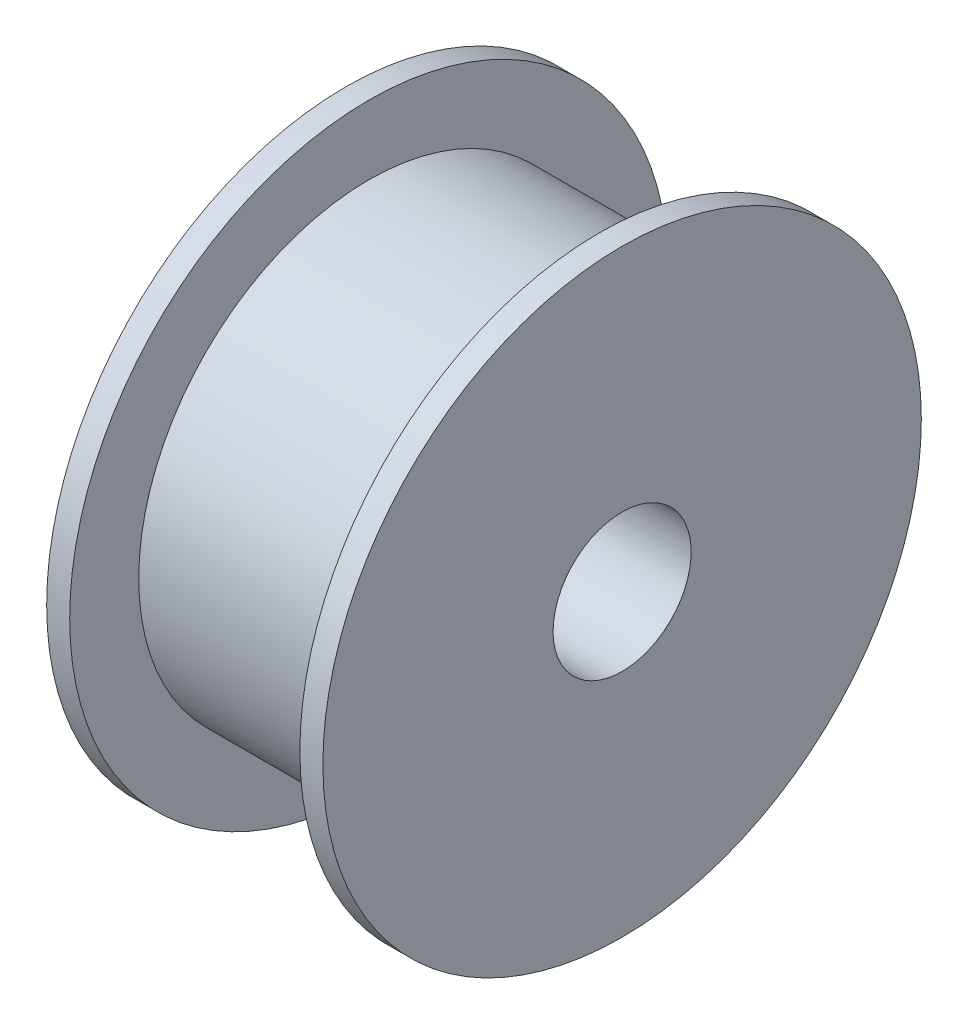
from build123d import *

# Parameters (mm, degrees)
SKETCH2_R          = 3
CUT_EXTRUDE1_DEPTH = 30.017236257


with BuildPart() as part:
    # Sketch1 → Revolve1 (revolve)
    with BuildSketch(Plane.XY, mode=Mode.PRIVATE) as revolve1_sk:
        Polygon((-6, 3), (-5, 3), (-5, 0), (5, 0), (5, 3), (6, 3), (6, -10), (-6, -10), align=None)
    revolve(revolve1_sk.sketch.rotate(Axis((-6, -10, 0), (1, 0, 0)), 90), axis=Axis((-6, -10, 0), (1, 0, 0)))

    # Sketch2 → Cut-Extrude1 (cut, through all)
    with BuildSketch(Plane.ZY.offset(6)):
        with Locations((0, -10)):
            Circle(SKETCH2_R)
    extrude(amount=-CUT_EXTRUDE1_DEPTH, mode=Mode.SUBTRACT)


solid = part.part
